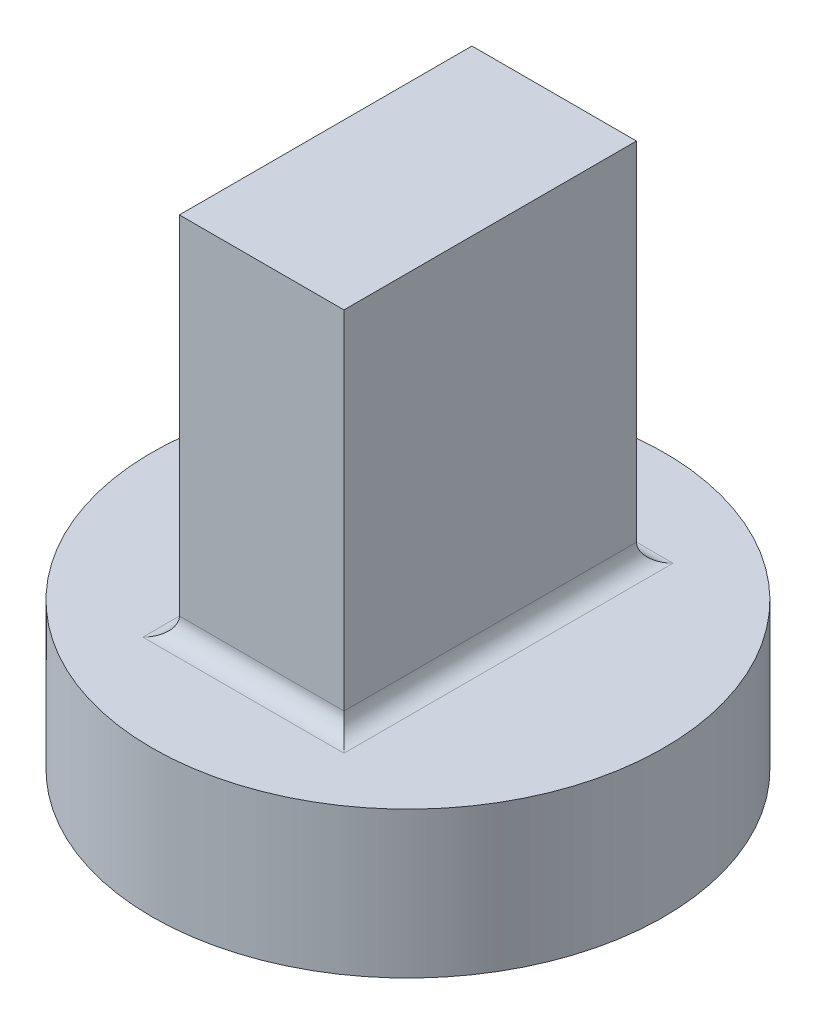
from build123d import *

# Parameters (mm, degrees)
SKETCH1_R           = 7
BOSS_EXTRUDE1_DEPTH = 4
SKETCH2_W           = 4.5
SKETCH2_H           = 8
BOSS_EXTRUDE2_DEPTH = 10
FILLET2_R           = 0.5


with BuildPart() as part:
    # Sketch1 → Boss-Extrude1 (new body)
    with BuildSketch(Plane(origin=(0, 0, 0), x_dir=(1, 0, 0), z_dir=(0, 1, 0))):
        with Locations(Location((0, 0, 0), (0, 0, 270))):
            Circle(SKETCH1_R)
    extrude(amount=BOSS_EXTRUDE1_DEPTH)

    # Sketch2 → Boss-Extrude2 (add)
    with BuildSketch(Plane(origin=(0, 4, 0), x_dir=(1, 0, 0), z_dir=(0, 1, 0))):
        Rectangle(SKETCH2_W, SKETCH2_H)
    extrude(amount=BOSS_EXTRUDE2_DEPTH)

    # Fillet2
    fillet2_edges = [part.edges().sort_by_distance(p)[0] for p in [
        (-2.25, 4, 0),
        (0, 4, 4),
        (2.25, 4, 0),
        (0, 4, -4),
    ]]
    fillet(fillet2_edges, radius=FILLET2_R)


solid = part.part
